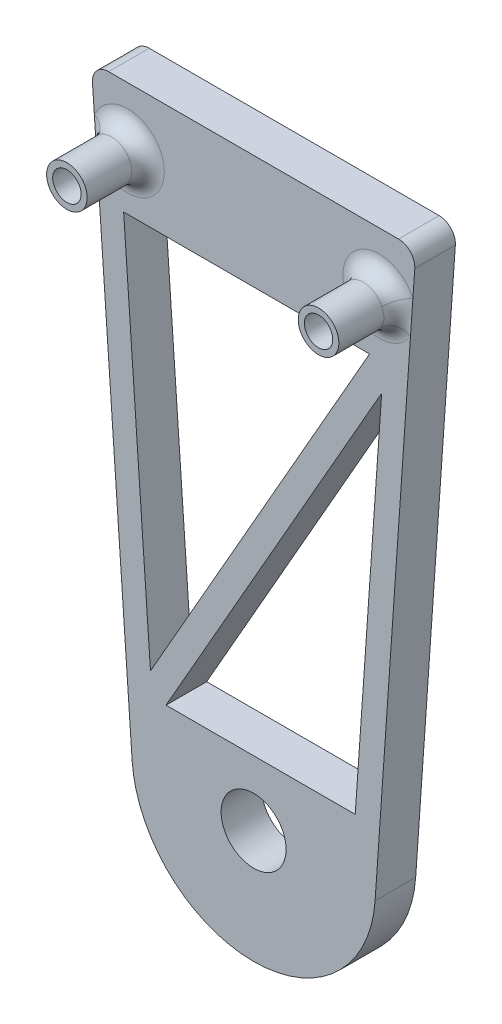
from build123d import *

# Parameters (mm, degrees)
CROQUIS1_R              = 4
CROQUIS1_R_2            = 1.75
SALIENTE_EXTRUIR1_DEPTH = 2.5
CROQUIS1_3_R            = 2.5
CROQUIS1_3_R_2          = 1.75
SALIENTE_EXTRUIR2_DEPTH = 10
REDONDEO1_R             = 2
REDONDEO2_R             = 2


with BuildPart() as part:
    # Croquis1 → Saliente-Extruir1 (new, symmetric)
    with BuildSketch(Plane.XY):
        with BuildLine():
            Line((20.001432119, 0), (-20.001432119, 0))
            Line((-20.001432119, 0), (-14.963460754, -72.046347106))
            ThreePointArc((-14.963460754, -72.046347106), (0, -86), (14.963460754, -72.046347106))
            Line((14.963460754, -72.046347106), (20.001432119, 0))
        make_face()
        with Locations((0, -72.046347106)):
            Circle(CROQUIS1_R, mode=Mode.SUBTRACT)
        Polygon((-12.704099543, -61.349956664), (-16.011890152, -14.046347106), (14.28491785, -14.046347106), align=None, mode=Mode.SUBTRACT)
        Polygon((12.515549555, -64.046347106), (-10.788577252, -64.046347106), (15.770666891, -17.496000466), align=None, mode=Mode.SUBTRACT)
        with Locations((-15.5, -7.276347106)):
            Circle(CROQUIS1_R_2, mode=Mode.SUBTRACT)
        with Locations((15.5, -7.276347106)):
            Circle(CROQUIS1_R_2, mode=Mode.SUBTRACT)
    extrude(amount=SALIENTE_EXTRUIR1_DEPTH, both=True)

    # Croquis1<3> → Saliente-Extruir2 (add)
    # profile 1 of 2: a face of its own
    with BuildSketch(Plane.XY):
        with Locations((-15.5, -7.276347106)):
            Circle(CROQUIS1_3_R)
        with Locations((-15.5, -7.276347106)):
            Circle(CROQUIS1_3_R_2, mode=Mode.SUBTRACT)
    # profile 2 of 2: a face of its own
    with BuildSketch(Plane.XY):
        with Locations((15.5, -7.276347106)):
            Circle(CROQUIS1_3_R)
        with Locations((15.5, -7.276347106)):
            Circle(CROQUIS1_3_R_2, mode=Mode.SUBTRACT)
    extrude(amount=SALIENTE_EXTRUIR2_DEPTH)

    # Redondeo1
    redondeo1_edges = [part.edges().sort_by_distance(p)[0] for p in [
        (13, -7.276347106, 2.5),
        (-18, -7.276347106, 2.5),
    ]]
    fillet(redondeo1_edges, radius=REDONDEO1_R)

    # Redondeo2
    redondeo2_edges = [part.edges().sort_by_distance(p)[0] for p in [
        (20.001432119, 0, 0),
        (-20.001432119, 0, 0),
    ]]
    fillet(redondeo2_edges, radius=REDONDEO2_R)


solid = part.part
